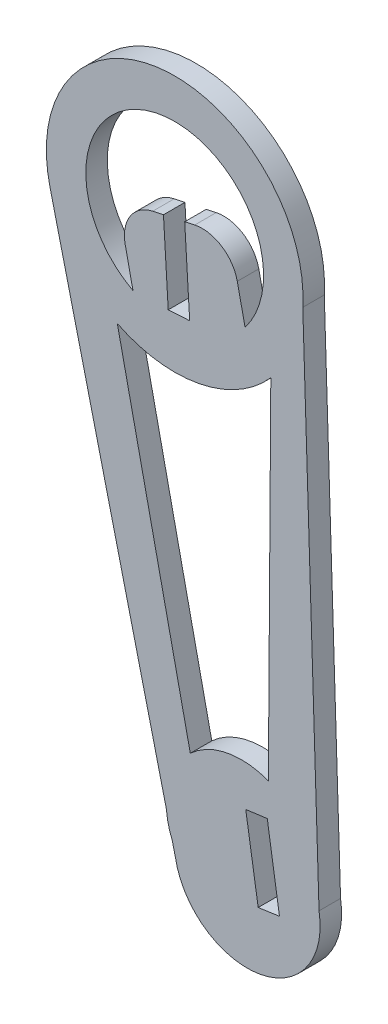
from build123d import *

# Parameters (mm, degrees)
BASE_EXTRUDE_DEPTH = 3
CUT_EXTRUDE2_DEPTH = 98
CUT_EXTRUDE6_DEPTH = 32


with BuildPart() as part:
    # Sketch1 → Base-Extrude (new body)
    with BuildSketch(Plane.XY):
        with BuildLine():
            Line((-1733.906004377, 29.697699618), (-1717.660054383, -37.356142617))
            ThreePointArc((-1717.660054383, -37.356142617), (-1717.392491193, -39.067926894), (-1716.846904921, -40.712351137))
            Line((-1716.846904921, -40.712351137), (-1716.417156793, -42.486101711))
            ThreePointArc((-1716.417156793, -42.486101711), (-1704.630486547, -50.750700002), (-1696.365888256, -38.964029756))
            Line((-1696.365888256, -38.964029756), (-1698.635055574, 32.835792941))
            ThreePointArc((-1698.635055574, 32.835792941), (-1718.097908318, 51.805768332), (-1733.906004377, 29.697699618))
        make_face()
        with BuildLine():
            Line((-1703.09668856, 22.095884858), (-1703.438627674, -26.79881214))
            ThreePointArc((-1703.438627674, -26.79881214), (-1709.186992556, -26.294688909), (-1714.332729754, -28.906054021))
            Line((-1714.332729754, -28.906054021), (-1724.517294461, 17.943098305))
            ThreePointArc((-1724.517294461, 17.943098305), (-1713.101655099, 16.381275869), (-1703.09668856, 22.095884858))
        make_face(mode=Mode.SUBTRACT)
        with BuildLine():
            Line((-1719.582465885, 33.977627673), (-1713.717650395, 35.244094915))
            ThreePointArc((-1713.717650395, 35.244094915), (-1709.952658337, 34.558897322), (-1707.774914786, 31.412138042))
            Line((-1707.774914786, 31.412138042), (-1706.689581956, 26.386128223))
            ThreePointArc((-1706.689581956, 26.386128223), (-1719.129096181, 46.090906116), (-1722.329089928, 23.008882245))
            Line((-1722.329089928, 23.008882245), (-1723.414422758, 28.034892064))
            ThreePointArc((-1723.414422758, 28.034892064), (-1722.729225165, 31.799884122), (-1719.582465885, 33.977627673))
        make_face(mode=Mode.SUBTRACT)
    extrude(amount=BASE_EXTRUDE_DEPTH)

    # Sketch2 → Cut-Extrude2 (cut)
    with BuildSketch(Plane.XY.offset(3)):
        Polygon((-1715.450740146, 40.629639019), (-1714.419013149, 23.325108151), (-1717.413695187, 23.146559866), (-1718.008856137, 33.128833327), (-1718.445422184, 40.451090735), align=None)
    extrude(amount=-CUT_EXTRUDE2_DEPTH, mode=Mode.SUBTRACT)

    # Sketch4 → Cut-Extrude6 (cut)
    with BuildSketch(Plane(origin=(0, 0, 0), x_dir=(-1, 0, 0), z_dir=(0, 0, -1))):
        Polygon((1704.858484276, -42.808076116), (1706.594681007, -31.821068487), (1703.587915488, -31.424502176), (1701.889253436, -42.379510814), align=None)
    extrude(amount=-CUT_EXTRUDE6_DEPTH, mode=Mode.SUBTRACT)


solid = part.part
